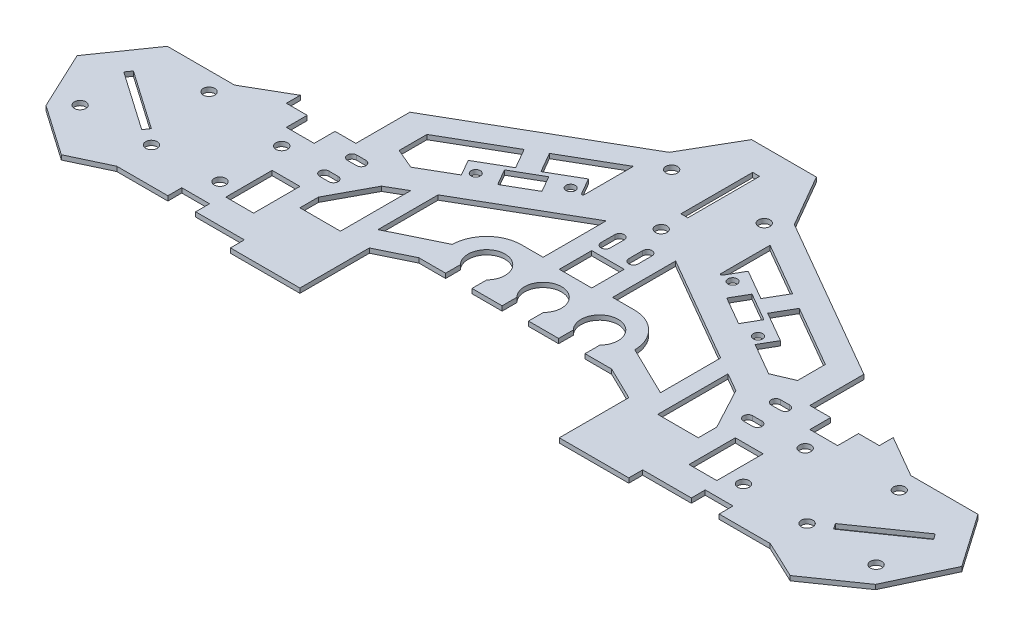
from build123d import *

# Parameters (mm, degrees)
SALIENTE_EXTRUIR1_DEPTH = 1
CROQUIS2_W              = 7
CROQUIS2_H              = 7
CROQUIS2_W_2            = 1.5
CROQUIS2_H_2            = 15.5
CROQUIS2_W_3            = 6
CROQUIS2_H_3            = 10
CORTAR_EXTRUIR1_DEPTH   = 1
CORTAR_EXTRUIR2_DEPTH   = 1
CROQUIS5_R              = 1.25
CROQUIS5_R_2            = 1
CORTAR_EXTRUIR3_DEPTH   = 10
CORTAR_EXTRUIR4_DEPTH   = 112.737415399


with BuildPart() as part:
    # Croquis1 → Saliente-Extruir1 (new body)
    with BuildSketch(Plane(origin=(0, 0, 0), x_dir=(1, 0, 0), z_dir=(0, 1, 0))):
        with BuildLine():
            Line((-7, 58), (7, 58))
            Line((7, 58), (13.5, 46.741669751))
            Line((13.5, 46.741669751), (49.007041555, 26.241669751))
            Line((49.007041555, 26.241669751), (49.007041555, 14.581415713))
            Line((49.007041555, 14.581415713), (53.507041555, 14.581415713))
            Line((53.507041555, 14.581415713), (53.507041555, 10.081415713))
            Line((53.507041555, 10.081415713), (59.507041555, 10.081415713))
            Line((59.507041555, 10.081415713), (59.507041555, 14.581415713))
            Line((59.507041555, 14.581415713), (64.007041555, 14.581415713))
            Line((64.007041555, 14.581415713), (64.007041555, 17.581415713))
            Line((64.007041555, 17.581415713), (73.007041555, 12.38526329))
            Line((73.007041555, 12.38526329), (87.507041555, 12.38526329))
            Line((87.507041555, 12.38526329), (95.5, 0.89123809))
            Line((95.5, 0.89123809), (89.542361407, -11.777879574))
            Line((89.542361407, -11.777879574), (78.682398273, -19.329910524))
            Line((78.682398273, -19.329910524), (70.537965489, -15.5))
            Line((70.537965489, -15.5), (59.507041555, -15.5))
            Line((59.507041555, -15.5), (59.507041555, -12.5))
            Line((59.507041555, -12.5), (53.507041555, -12.5))
            Line((53.507041555, -12.5), (53.507041555, -15.5))
            Line((53.507041555, -15.5), (43, -15.5))
            Line((43, -15.5), (43, -18.5))
            Line((43, -18.5), (28, -18.5))
            Line((28, -18.5), (28, -3.5))
            Line((28, -3.5), (20.806252715, 0))
            Line((20.806252715, 0), (15.05, 0))
            Line((15.05, 0), (15.05, 3.19331156))
            ThreePointArc((15.05, 3.19331156), (12.2, 10), (9.35, 3.19331156))
            Line((9.35, 3.19331156), (9.35, 0))
            Line((9.35, 0), (2.85, 0))
            Line((2.85, 0), (2.85, 3.19331156))
            ThreePointArc((2.85, 3.19331156), (0, 10), (-2.85, 3.19331156))
            Line((-2.85, 3.19331156), (-2.85, 0))
            Line((-2.85, 0), (-9.35, 0))
            Line((-9.35, 0), (-9.35, 3.19331156))
            ThreePointArc((-9.35, 3.19331156), (-12.2, 10), (-15.05, 3.19331156))
            Line((-15.05, 3.19331156), (-15.05, 0))
            Line((-15.05, 0), (-20.806252715, 0))
            Line((-20.806252715, 0), (-28, -3.5))
            Line((-28, -3.5), (-28, -18.5))
            Line((-28, -18.5), (-43, -18.5))
            Line((-43, -18.5), (-43, -15.5))
            Line((-43, -15.5), (-53.507041555, -15.5))
            Line((-53.507041555, -15.5), (-53.507041555, -12.5))
            Line((-53.507041555, -12.5), (-59.507041555, -12.5))
            Line((-59.507041555, -12.5), (-59.507041555, -15.5))
            Line((-59.507041555, -15.5), (-70.537965489, -15.5))
            Line((-70.537965489, -15.5), (-78.682398273, -19.329910524))
            Line((-78.682398273, -19.329910524), (-89.542361407, -11.777879574))
            Line((-89.542361407, -11.777879574), (-95.5, 0.89123809))
            Line((-95.5, 0.89123809), (-87.507041555, 12.38526329))
            Line((-87.507041555, 12.38526329), (-73.007041555, 12.38526329))
            Line((-73.007041555, 12.38526329), (-64.007041555, 17.581415713))
            Line((-64.007041555, 17.581415713), (-64.007041555, 14.581415713))
            Line((-64.007041555, 14.581415713), (-59.507041555, 14.581415713))
            Line((-59.507041555, 14.581415713), (-59.507041555, 10.081415713))
            Line((-59.507041555, 10.081415713), (-53.507041555, 10.081415713))
            Line((-53.507041555, 10.081415713), (-53.507041555, 14.581415713))
            Line((-53.507041555, 14.581415713), (-49.007041555, 14.581415713))
            Line((-49.007041555, 14.581415713), (-49.007041555, 26.241669751))
            Line((-49.007041555, 26.241669751), (-13.5, 46.741669751))
            Line((-13.5, 46.741669751), (-7, 58))
        make_face()
    extrude(amount=SALIENTE_EXTRUIR1_DEPTH)

    # Croquis2 → Cortar-Extruir1 (cut)
    with BuildSketch(Plane(origin=(0, 1, 0), x_dir=(1, 0, 0), z_dir=(0, 1, 0))):
        with Locations((0, 16.5)):
            Rectangle(CROQUIS2_W, CROQUIS2_H)
        with Locations((0, 44.25)):
            Rectangle(CROQUIS2_W_2, CROQUIS2_H_2)
        with BuildLine():
            Line((4, 25.5), (4, 22.5))
            ThreePointArc((4, 22.5), (3, 21.5), (2, 22.5))
            Line((2, 22.5), (2, 25.5))
            ThreePointArc((2, 25.5), (3, 26.5), (4, 25.5))
        make_face()
        Polygon((34.25, -3.5), (43, -3.5), (43, 0.5), (38.25, 9.358239821), (34.25, 11.667640898), align=None)
        with Locations((50, -4.5)):
            Rectangle(CROQUIS2_W_3, CROQUIS2_H_3)
        with BuildLine():
            Line((-4, 25.5), (-4, 22.5))
            ThreePointArc((-4, 22.5), (-3, 21.5), (-2, 22.5))
            Line((-2, 22.5), (-2, 25.5))
            ThreePointArc((-2, 25.5), (-3, 26.5), (-4, 25.5))
        make_face()
        with Locations((-50, -4.5)):
            Rectangle(CROQUIS2_W_3, CROQUIS2_H_3)
        Polygon((-38.25, 9.358239821), (-34.25, 11.667640898), (-34.25, -3.5), (-43, -3.5), (-43, 0.5), align=None)
        Polygon((73.834288775, -4.735435627), (86.559816675, 4.113911223), (87.41620508, 2.882408523), (74.69067718, -5.966938327), align=None)
        Polygon((-86.559816675, 4.113911223), (-87.41620508, 2.882408523), (-74.69067718, -5.966938327), (-73.834288775, -4.735435627), align=None)
        with BuildLine():
            Line((44.75, 6.5), (46.75, 6.5))
            ThreePointArc((46.75, 6.5), (47.75, 5.5), (46.75, 4.5))
            Line((46.75, 4.5), (44.75, 4.5))
            ThreePointArc((44.75, 4.5), (43.75, 5.5), (44.75, 6.5))
        make_face()
        with BuildLine():
            Line((44.75, 12.5), (46.75, 12.5))
            ThreePointArc((46.75, 12.5), (47.75, 11.5), (46.75, 10.5))
            Line((46.75, 10.5), (44.75, 10.5))
            ThreePointArc((44.75, 10.5), (43.75, 11.5), (44.75, 12.5))
        make_face()
        with BuildLine():
            Line((-44.75, 12.5), (-46.75, 12.5))
            ThreePointArc((-46.75, 12.5), (-47.75, 11.5), (-46.75, 10.5))
            Line((-46.75, 10.5), (-44.75, 10.5))
            ThreePointArc((-44.75, 10.5), (-43.75, 11.5), (-44.75, 12.5))
        make_face()
        with BuildLine():
            Line((-44.75, 6.5), (-46.75, 6.5))
            ThreePointArc((-46.75, 6.5), (-47.75, 5.5), (-46.75, 4.5))
            Line((-46.75, 4.5), (-44.75, 4.5))
            ThreePointArc((-44.75, 4.5), (-43.75, 5.5), (-44.75, 6.5))
        make_face()
    extrude(amount=-CORTAR_EXTRUIR1_DEPTH, mode=Mode.SUBTRACT)

    # Croquis4 → Cortar-Extruir2 (cut)
    with BuildSketch(Plane(origin=(0, 1, 0), x_dir=(1, 0, 0), z_dir=(0, 1, 0))):
        with BuildLine():
            Line((19.699347482, 6.098930999), (30.5, 0.844050293))
            Line((30.5, 0.844050293), (30.5, 13.832704407))
            Line((30.5, 13.832704407), (7.5, 27.111760598))
            Line((7.5, 27.111760598), (7.5, 13.5))
            Line((7.5, 13.5), (12.2, 13.5))
            ThreePointArc((12.2, 13.5), (17.468207357, 11.338163659), (19.699347482, 6.098930999))
        make_face()
        with BuildLine():
            Line((-7.5, 13.5), (-12.2, 13.5))
            ThreePointArc((-12.2, 13.5), (-17.468207357, 11.338163659), (-19.699347482, 6.098930999))
            Line((-19.699347482, 6.098930999), (-30.5, 0.844050293))
            Line((-30.5, 0.844050293), (-30.5, 13.832704407))
            Line((-30.5, 13.832704407), (-7.5, 27.111760598))
            Line((-7.5, 27.111760598), (-7.5, 13.5))
        make_face()
    extrude(amount=-CORTAR_EXTRUIR2_DEPTH, mode=Mode.SUBTRACT)

    # Croquis5 → Cortar-Extruir3 (cut)
    with BuildSketch(Plane(origin=(0, 1, 0), x_dir=(1, 0, 0), z_dir=(0, 1, 0))):
        with Locations(Location((10, 43.75, 0), (0, 0, 270))):
            Circle(CROQUIS5_R)
        with Locations(Location((-10, 43.75, 0), (0, 0, 270))):
            Circle(CROQUIS5_R)
        with Locations(Location((0, 31.5, 0), (0, 0, 270))):
            Circle(CROQUIS5_R)
        with Locations(Location((56.507041555, 6.081415713, 0), (0, 0, 270))):
            Circle(CROQUIS5_R)
        with Locations(Location((-56.507041555, 6.081415713, 0), (0, 0, 270))):
            Circle(CROQUIS5_R)
        with Locations(Location((74.507041555, 8.38526329, 0), (0, 0, 270))):
            Circle(CROQUIS5_R)
        with Locations(Location((-74.507041555, 8.38526329, 0), (0, 0, 270))):
            Circle(CROQUIS5_R)
        with Locations(Location((56.507041555, -7.25, 0), (0, 0, 270))):
            Circle(CROQUIS5_R)
        with Locations(Location((-56.507041555, -7.25, 0), (0, 0, 270))):
            Circle(CROQUIS5_R)
        with Locations(Location((85.925553619, -8.03477271, 0), (0, 0, 270))):
            Circle(CROQUIS5_R)
        with Locations(Location((70.773225328, -7.777620791, 0), (0, 0, 270))):
            Circle(CROQUIS5_R)
        with Locations(Location((-85.925553619, -8.03477271, 0), (0, 0, 270))):
            Circle(CROQUIS5_R)
        with Locations(Location((-70.773225328, -7.777620791, 0), (0, 0, 270))):
            Circle(CROQUIS5_R)
        with Locations(Location((17.480762114, 29.432268674, 0), (0, 0, 270))):
            Circle(CROQUIS5_R_2)
        with Locations(Location((30.47114317, 21.932268674, 0), (0, 0, 270))):
            Circle(CROQUIS5_R_2)
        with Locations(Location((-30.47114317, 21.932268674, 0), (0, 0, 270))):
            Circle(CROQUIS5_R_2)
        with Locations(Location((-17.480762114, 29.432268674, 0), (0, 0, 270))):
            Circle(CROQUIS5_R_2)
        Polygon((21.944863729, 29.164319482), (28.007041555, 25.664319482), (26.007041555, 22.200217866), (19.944863729, 25.700217866), align=None)
        Polygon((-28.007041555, 25.664319482), (-26.007041555, 22.200217866), (-19.944863729, 25.700217866), (-21.944863729, 29.164319482), align=None)
    extrude(amount=-CORTAR_EXTRUIR3_DEPTH, mode=Mode.SUBTRACT)

    # Croquis7 → Cortar-Extruir4 (cut, through all)
    with BuildSketch(Plane(origin=(0, 1, 0), x_dir=(1, 0, 0), z_dir=(0, 1, 0))):
        with BuildLine():
            Line((14.75, 29.635462652), (14.75, 40.246479222))
            Line((14.75, 40.246479222), (26.243901834, 33.610471904))
            Line((26.243901834, 33.610471904), (23.743901834, 29.280344885))
            Line((23.743901834, 29.280344885), (17.248711306, 33.030344885))
            Line((17.248711306, 33.030344885), (15.216506351, 29.510462652))
            ThreePointArc((15.216506351, 29.510462652), (14.935295239, 29.393981195), (14.75, 29.635462652))
        make_face()
        Polygon((29.708003449, 31.610471904), (43.007041555, 23.932268674), (43.007041555, 17.932268674), (38.631397208, 16.06624327), (31.703193978, 20.06624327), (33.703193978, 23.530344885), (27.208003449, 27.280344885), align=None)
        Polygon((-27.208003449, 27.280344885), (-29.708003449, 31.610471904), (-43.007041555, 23.932268674), (-43.007041555, 17.932268674), (-38.631397208, 16.06624327), (-31.703193978, 20.06624327), (-33.703193978, 23.530344885), align=None)
        with BuildLine():
            Line((-17.248711306, 33.030344885), (-15.216506351, 29.510462652))
            ThreePointArc((-15.216506351, 29.510462652), (-14.935295239, 29.393981195), (-14.75, 29.635462652))
            Line((-14.75, 29.635462652), (-14.75, 40.246479222))
            Line((-14.75, 40.246479222), (-26.243901834, 33.610471904))
            Line((-26.243901834, 33.610471904), (-23.743901834, 29.280344885))
            Line((-23.743901834, 29.280344885), (-17.248711306, 33.030344885))
        make_face()
    extrude(amount=-CORTAR_EXTRUIR4_DEPTH, mode=Mode.SUBTRACT)


solid = part.part
